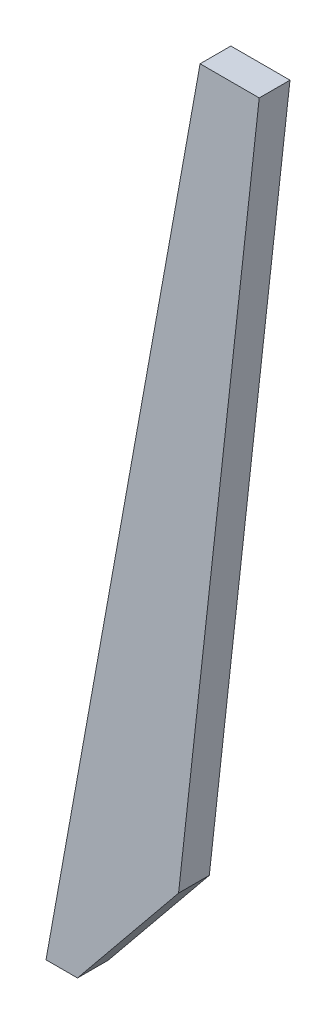
from build123d import *

# Parameters (mm, degrees)
BOSS_EXTRUDE1_DEPTH = 15
SCALE1_SCALE        = 0.6


with BuildPart() as part:
    # Sketch3 → Boss-Extrude1 (new body)
    with BuildSketch(Plane.XY):
        Polygon((400.577201165, 416), (361.233423479, 60.489600344), (311.944825715, 0), (296.597151769, 0), (371.734942748, 416), align=None)
    extrude(amount=BOSS_EXTRUDE1_DEPTH)


with BuildPart() as part_1:
    # Scale1: scaled about (353.237254905, 197.400686377, 7.5)
    add(part.part.scale(SCALE1_SCALE).moved(Location((141.294901962, 78.960274551, 3))))


solid = part_1.part
